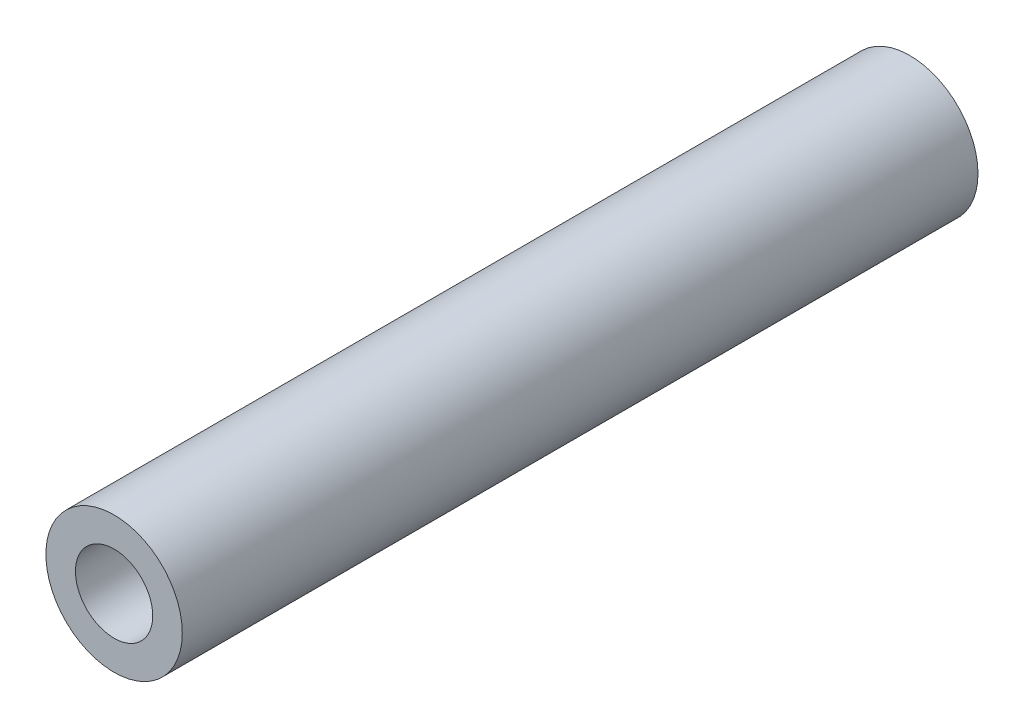
from build123d import *

# Parameters (mm, degrees)
SKETCH1_R           = 3
SKETCH1_R_2         = 1.7
RING_ENVELOPE_DEPTH = 35


with BuildPart() as part:
    # Sketch1 → Ring_Envelope (new body)
    with BuildSketch(Plane.XY):
        Circle(SKETCH1_R)
        Circle(SKETCH1_R_2, mode=Mode.SUBTRACT)
    extrude(amount=RING_ENVELOPE_DEPTH)


solid = part.part
